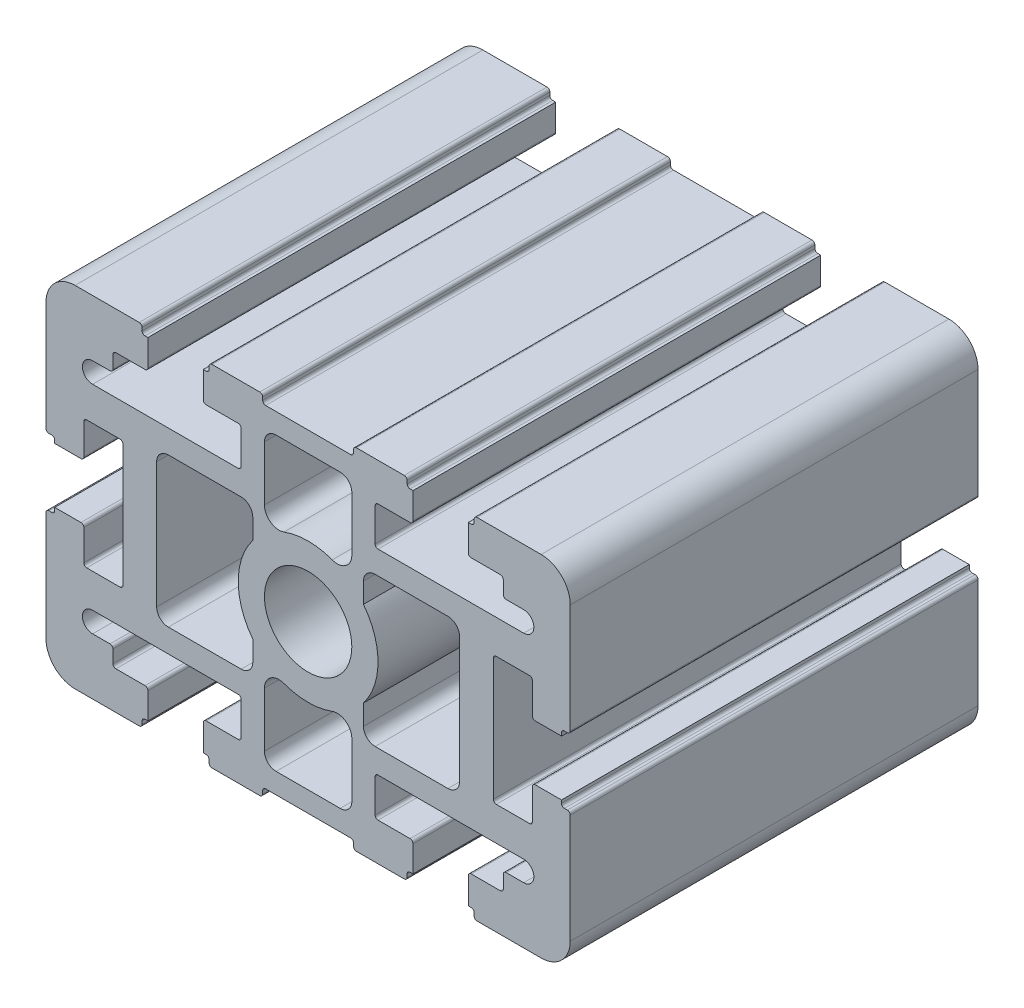
from build123d import *

# Parameters (mm, degrees)
Y_KSEKLIK_EKSTR_ZYON1_DEPTH = 70


with BuildPart() as part:
    # Çizim3 → Yükseklik-Ekstrüzyon1 (new body)
    with BuildSketch(Plane.XY):
        with BuildLine():
            Line((-43.5, 4.75), (-39, 4.75))
            ThreePointArc((-39, 4.75), (-38.646446609, 4.896446609), (-38.5, 5.25))
            Line((-38.5, 5.25), (-38.5, 10.5))
            ThreePointArc((-38.5, 10.5), (-38.353553391, 10.853553391), (-38, 11))
            Line((-38, 11), (-32.3, 11))
            ThreePointArc((-32.3, 11), (-31.946446609, 10.853553391), (-31.8, 10.5))
            Line((-31.8, 10.5), (-31.8, 0))
            Line((-31.8, 0), (-26, 0))
            Line((-26, 0), (-26, 10.8))
            ThreePointArc((-26, 10.8), (-25.414213562, 12.214213562), (-24, 12.8))
            Line((-24, 12.8), (-11.5, 12.8))
            ThreePointArc((-11.5, 12.8), (-10.085786438, 12.214213562), (-9.5, 10.8))
            Line((-9.5, 10.8), (-9.5, 7.331439149))
            ThreePointArc((-9.5, 7.331439149), (-11.357816692, 3.872983346), (-12, 0))
            Line((-12, 0), (-7.5, 0))
            ThreePointArc((-7.5, 0), (-5.303300859, 5.303300859), (0, 7.5))
            Line((0, 7.5), (0, 12))
            ThreePointArc((0, 12), (-2.101438811, 11.814565372), (-4.137931034, 11.263992487))
            ThreePointArc((-4.137931034, 11.263992487), (-6.430878679, 11.560636563), (-7.5, 13.610657589))
            Line((-7.5, 13.610657589), (-7.5, 23))
            ThreePointArc((-7.5, 23), (-6.914213562, 24.414213562), (-5.5, 25))
            Line((-5.5, 25), (0, 25))
            Line((0, 25), (0, 28.5))
            Line((0, 28.5), (-7.3, 28.5))
            ThreePointArc((-7.3, 28.5), (-7.653553391, 28.646446609), (-7.8, 29))
            Line((-7.8, 29), (-7.8, 29.5))
            ThreePointArc((-7.8, 29.5), (-7.946446609, 29.853553391), (-8.3, 30))
            Line((-8.3, 30), (-16.5, 30))
            ThreePointArc((-16.5, 30), (-16.853553391, 29.853553391), (-17, 29.5))
            Line((-17, 29.5), (-17, 29))
            ThreePointArc((-17, 29), (-17.146446609, 28.646446609), (-17.5, 28.5))
            Line((-17.5, 28.5), (-18, 28.5))
            Line((-18, 28.5), (-18, 24))
            ThreePointArc((-18, 24), (-17.853553391, 23.646446609), (-17.5, 23.5))
            Line((-17.5, 23.5), (-12, 23.5))
            ThreePointArc((-12, 23.5), (-11.646446609, 23.353553391), (-11.5, 23))
            Line((-11.5, 23), (-11.5, 17.3))
            ThreePointArc((-11.5, 17.3), (-11.646446609, 16.946446609), (-12, 16.8))
            Line((-12, 16.8), (-37, 16.8))
            ThreePointArc((-37, 16.8), (-38.75, 18.55), (-37, 20.3))
            Line((-37, 20.3), (-34, 20.3))
            ThreePointArc((-34, 20.3), (-33.646446609, 20.446446609), (-33.5, 20.8))
            Line((-33.5, 20.8), (-33.5, 23))
            ThreePointArc((-33.5, 23), (-33.353553391, 23.353553391), (-33, 23.5))
            Line((-33, 23.5), (-28, 23.5))
            ThreePointArc((-28, 23.5), (-27.646446609, 23.646446609), (-27.5, 24))
            Line((-27.5, 24), (-27.5, 28.5))
            Line((-27.5, 28.5), (-28, 28.5))
            ThreePointArc((-28, 28.5), (-28.353553391, 28.646446609), (-28.5, 29))
            Line((-28.5, 29), (-28.5, 29.5))
            ThreePointArc((-28.5, 29.5), (-28.646446609, 29.853553391), (-29, 30))
            Line((-29, 30), (-40, 30))
            ThreePointArc((-40, 30), (-43.535533906, 28.535533906), (-45, 25))
            Line((-45, 25), (-45, 6.25))
            ThreePointArc((-45, 6.25), (-44.853553391, 5.896446609), (-44.5, 5.75))
            Line((-44.5, 5.75), (-44, 5.75))
            ThreePointArc((-44, 5.75), (-43.646446609, 5.603553391), (-43.5, 5.25))
            Line((-43.5, 5.25), (-43.5, 4.75))
        make_face()
    extrude(amount=Y_KSEKLIK_EKSTR_ZYON1_DEPTH)

    # Aynalama1: part across plane


with BuildPart() as part_1:
    add(part.part)
    add(part.part.mirror(Plane(origin=(0, 0, 70), x_dir=(0, 0, 1), z_dir=(1, 0, 0))))

    # Aynalama2: part across plane


with BuildPart() as part_2:
    add(part_1.part)
    add(part_1.part.mirror(Plane(origin=(0, 0, 70), x_dir=(0, 0, 1), z_dir=(0, 1, 0))))


solid = part_2.part
